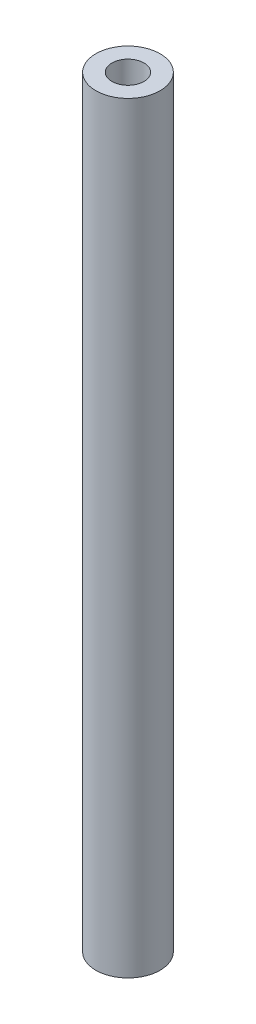
from build123d import *

# Parameters (mm, degrees)
CROQUIS1_R              = 4.7625
SALIENTE_EXTRUIR1_DEPTH = 113
CROQUIS2_R              = 2.38125
CORTAR_EXTRUIR1_DEPTH   = 10


with BuildPart() as part:
    # Croquis1 → Saliente-Extruir1 (new body)
    with BuildSketch(Plane(origin=(0, 0, 0), x_dir=(1, 0, 0), z_dir=(0, 1, 0))):
        with Locations(Location((0, 0, 0), (0, 0, 270))):
            Circle(CROQUIS1_R)
    extrude(amount=SALIENTE_EXTRUIR1_DEPTH)

    # Croquis2 → Cortar-Extruir1 (cut)
    with BuildSketch(Plane(origin=(0, 113, 0), x_dir=(1, 0, 0), z_dir=(0, 1, 0))):
        with Locations(Location((0, 0, 0), (0, 0, 270))):
            Circle(CROQUIS2_R)
    cortar_extruir1 = extrude(amount=-CORTAR_EXTRUIR1_DEPTH, mode=Mode.SUBTRACT)

    # Simetría1: Cortar-Extruir1 across plane
    add(cortar_extruir1.mirror(Plane.ZX.offset(56.5)), mode=Mode.SUBTRACT)


solid = part.part
